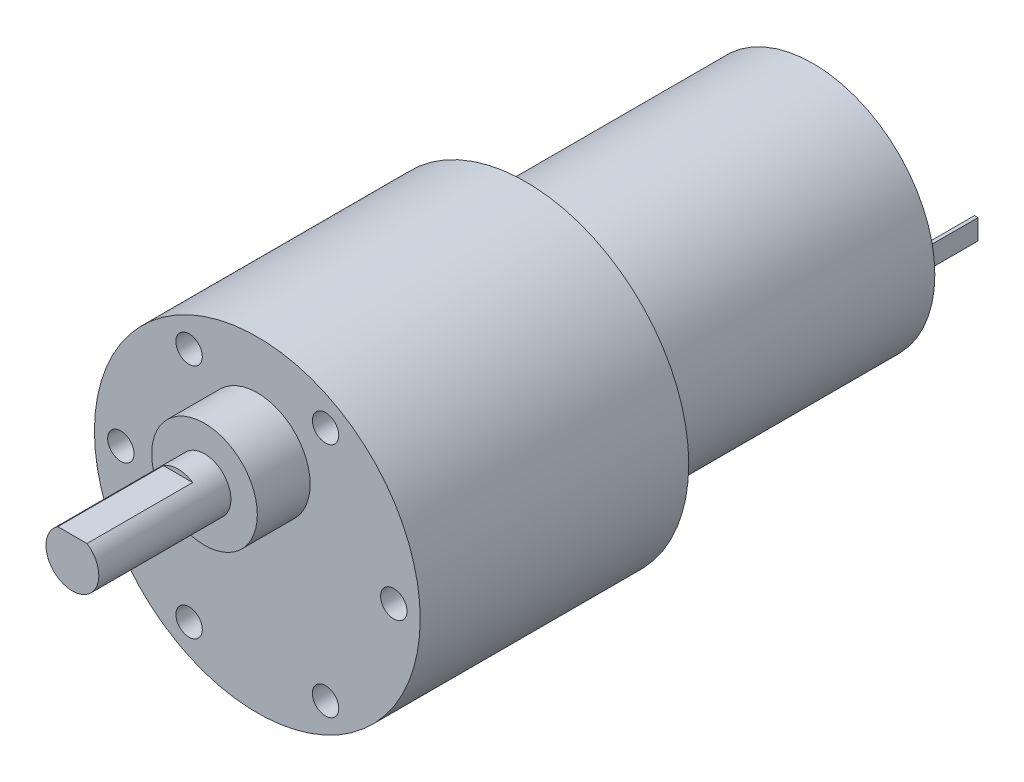
from build123d import *

# Parameters (mm, degrees)
SKETCH_1_R          = 13.85
EXTRUDE_1_DEPTH     = 32.6
SKETCH_2_R          = 18.5
EXTRUDE_2_DEPTH     = 30.5
SKETCH_3_R          = 6
EXTRUDE_3_DEPTH     = 6
SKETCH_4_R          = 3
EXTRUDE_4_DEPTH     = 15
CUT_EXTRUDE_START   = -12
CUT_EXTRUDE_1_DEPTH = 12
SKETCH_6_R          = 1.5
CUT_EXTRUDE_2_DEPTH = 3.5
SKETCH_7_R          = 5
EXTRUDE_5_DEPTH     = 2.6
EXTRUDE_START       = -2.6
SKETCH_8_R          = 1.15
EXTRUDE_6_DEPTH     = 8.5
SKETCH_9_W          = 0.4
SKETCH_9_H          = 2.3
EXTRUDE_7_DEPTH     = 6.9


with BuildPart() as part:
    # ｽｹｯﾁ1 → ﾎﾞｽ - 押し出し1 (new body)
    with BuildSketch(Plane.XY):
        Circle(SKETCH_1_R)
    extrude(amount=EXTRUDE_1_DEPTH)

    # ｽｹｯﾁ2 → ﾎﾞｽ - 押し出し2 (add)
    with BuildSketch(Plane.XY.offset(32.6)):
        with Locations(Location((0, 0, 0), (0, 0, 180))):
            Circle(SKETCH_2_R)
    extrude(amount=EXTRUDE_2_DEPTH)

    # ｽｹｯﾁ3 → ﾎﾞｽ - 押し出し3 (add)
    with BuildSketch(Plane.XY.offset(63.1)):
        with Locations((0, 7)):
            Circle(SKETCH_3_R)
    extrude(amount=EXTRUDE_3_DEPTH)

    # ｽｹｯﾁ4 → ﾎﾞｽ - 押し出し4 (add)
    with BuildSketch(Plane.XY.offset(69.1)):
        with Locations((0, 7)):
            Circle(SKETCH_4_R)
    extrude(amount=EXTRUDE_4_DEPTH)

    # ｽｹｯﾁ5 → ｶｯﾄ - 押し出し1 (cut)
    with BuildSketch(Plane.XY.offset(84.1).offset(CUT_EXTRUDE_START)):
        with BuildLine():
            Line((-1.658312395, 9.5), (1.658312395, 9.5))
            ThreePointArc((1.658312395, 9.5), (0, 10), (-1.658312395, 9.5))
        make_face()
    extrude(amount=CUT_EXTRUDE_1_DEPTH, mode=Mode.SUBTRACT)

    # ｽｹｯﾁ6 → ｶｯﾄ - 押し出し2 (cut)
    with BuildSketch(Plane.XY.offset(63.1)):
        with Locations((-15.5, 0)):
            Circle(SKETCH_6_R)
        with Locations((-7.75, 13.423393759)):
            Circle(SKETCH_6_R)
        with Locations((7.75, 13.423393759)):
            Circle(SKETCH_6_R)
        with Locations((15.5, 0)):
            Circle(SKETCH_6_R)
        with Locations((7.75, -13.423393759)):
            Circle(SKETCH_6_R)
        with Locations((-7.75, -13.423393759)):
            Circle(SKETCH_6_R)
    extrude(amount=-CUT_EXTRUDE_2_DEPTH, mode=Mode.SUBTRACT)

    # ｽｹｯﾁ7 → ﾎﾞｽ - 押し出し5 (add)
    with BuildSketch(Plane(origin=(0, 0, 0), x_dir=(-1, 0, 0), z_dir=(0, 0, -1))):
        Circle(SKETCH_7_R)
    extrude(amount=EXTRUDE_5_DEPTH)

    # ｽｹｯﾁ8 → ﾎﾞｽ - 押し出し6 (add)
    with BuildSketch(Plane(origin=(0, 0, -2.6), x_dir=(-1, 0, 0), z_dir=(0, 0, -1)).offset(EXTRUDE_START)):
        with Locations(Location((0, 0, 0), (0, 0, 180))):
            Circle(SKETCH_8_R)
    extrude(amount=EXTRUDE_6_DEPTH)

    # ｽｹｯﾁ9 → ﾎﾞｽ - 押し出し7 (add)
    with BuildSketch(Plane(origin=(0, 0, 0), x_dir=(-1, 0, 0), z_dir=(0, 0, -1))):
        with Locations((11.65, 0)):
            Rectangle(SKETCH_9_W, SKETCH_9_H)
        with Locations((-11.65, 0)):
            Rectangle(SKETCH_9_W, SKETCH_9_H)
    extrude(amount=EXTRUDE_7_DEPTH)


solid = part.part
